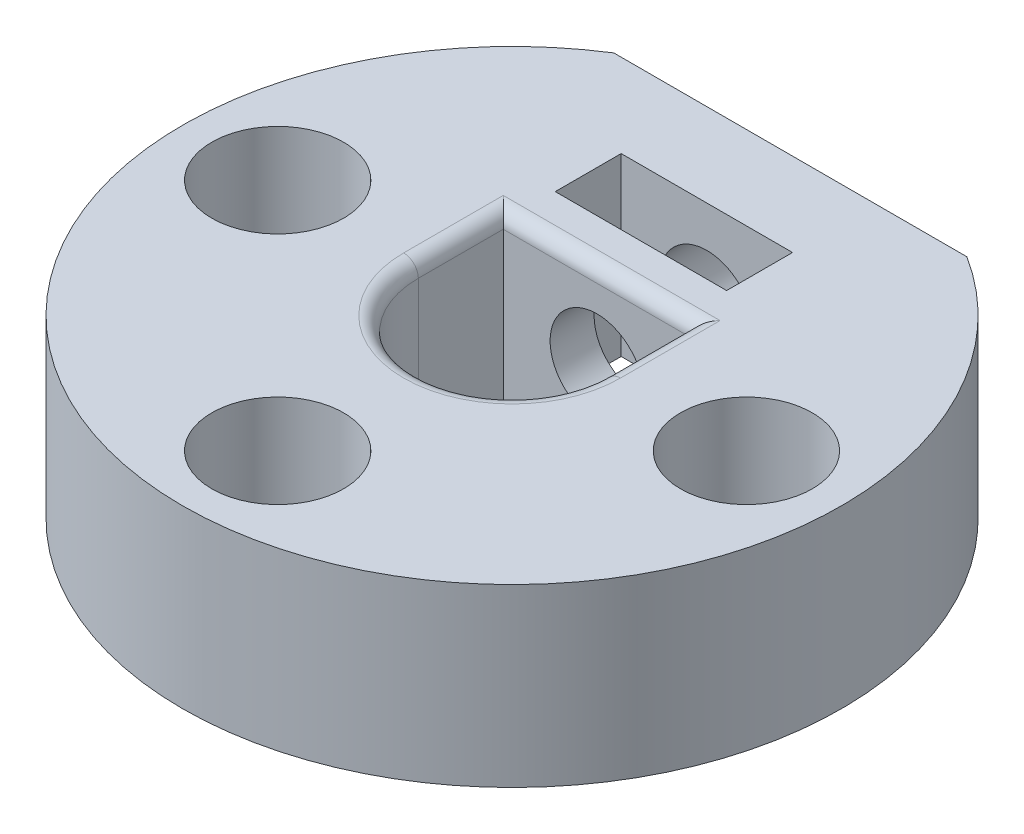
from build123d import *

# Parameters (mm, degrees)
BOSS_EXTRU_1_DEPTH             = 6
CBORE_FOR_M2_SHCS1_D           = 2.5
CBORE_FOR_M2_SHCS1_CBORE_D     = 4.5
CBORE_FOR_M2_SHCS1_CBORE_DEPTH = 4
CONG_1_R                       = 0.5
ESQUISSE6_R                    = 1.6
ENL_V_MAT_EXTRU_1_DEPTH        = 18.003676108
ESQUISSE7_W                    = 5.85
ESQUISSE7_H                    = 2.25
ENL_V_MAT_EXTRU_2_DEPTH        = 7.25


with BuildPart() as part:
    # Esquisse1 → Boss.-Extru.1 (new body)
    with BuildSketch(Plane(origin=(0, 0, 0), x_dir=(1, 0, 0), z_dir=(0, 1, 0))):
        with BuildLine():
            Line((6.025985397, 9.5), (-6.025985397, 9.5))
            ThreePointArc((-6.025985397, 9.5), (0, -11.25), (6.025985397, 9.5))
        make_face()
        with BuildLine():
            Line((-3.2, 0), (-3.2, 2.9))
            Line((-3.2, 2.9), (3.2, 2.9))
            Line((3.2, 2.9), (3.2, 0))
            ThreePointArc((3.2, 0), (0, -3.2), (-3.2, 0))
        make_face(mode=Mode.SUBTRACT)
    extrude(amount=BOSS_EXTRU_1_DEPTH)

    # CBORE for M2 SHCS1 (through all)
    with Locations(Plane(origin=(0, 6, 0), x_dir=(1, 0, 0), z_dir=(0, 1, 0))):
        with Locations((8, 0), (-8, 0), (0, 0), (0, -8)):
            CounterBoreHole(CBORE_FOR_M2_SHCS1_D / 2, CBORE_FOR_M2_SHCS1_CBORE_D / 2, CBORE_FOR_M2_SHCS1_CBORE_DEPTH)

    # Congé1
    cong_1_edges = [part.edges().sort_by_distance(p)[0] for p in [
        (0, 6, 3.2),
        (3.2, 6, -1.45),
        (0, 6, -2.9),
        (-3.2, 6, -1.45),
    ]]
    fillet(cong_1_edges, radius=CONG_1_R)

    # Esquisse6 → Enlèv. mat.-Extru.1 (cut, through all)
    with BuildSketch(Plane.XY):
        with Locations((0, 3)):
            Circle(ESQUISSE6_R)
    extrude(amount=-ENL_V_MAT_EXTRU_1_DEPTH, mode=Mode.SUBTRACT)

    # Esquisse7 → Enlèv. mat.-Extru.2 (cut)
    with BuildSketch(Plane(origin=(0, 0, 0), x_dir=(1, 0, 0), z_dir=(0, 1, 0))):
        with Locations((0, 5.525)):
            Rectangle(ESQUISSE7_W, ESQUISSE7_H)
    extrude(amount=ENL_V_MAT_EXTRU_2_DEPTH, mode=Mode.SUBTRACT)


solid = part.part
